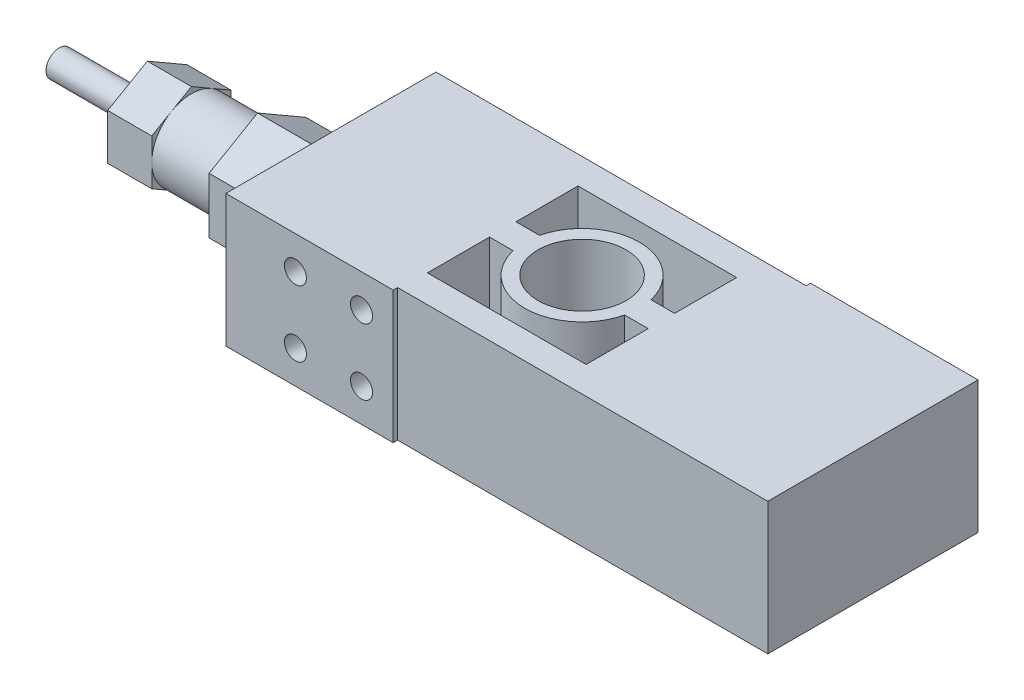
from build123d import *

# Parameters (mm, degrees)
IZIM1_W                     = 122
IZIM1_H                     = 30
Y_KSEKLIK_EKSTR_ZYON1_DEPTH = 46.7
IZIM2_W                     = 38
IZIM2_H                     = 30
Y_KSEKLIK_EKSTR_ZYON2_DEPTH = 1
IZIM3_R                     = 2.5
KES_EKSTR_ZYON1_DEPTH       = 20
KES_EKSTR_ZYON2_DEPTH       = 38
IZIM5_R                     = 10
KES_EKSTR_ZYON3_DEPTH       = 38
Y_KSEKLIK_EKSTR_ZYON3_DEPTH = 14.5
IZIM7_R                     = 9
Y_KSEKLIK_EKSTR_ZYON4_DEPTH = 15
IZIM8_W                     = 38
IZIM8_H                     = 30
Y_KSEKLIK_EKSTR_ZYON5_DEPTH = 1
IZIM9_R                     = 2.5
KES_EKSTR_ZYON4_DEPTH       = 20
Y_KSEKLIK_EKSTR_ZYON6_DEPTH = 10
IZIM11_R                    = 3
Y_KSEKLIK_EKSTR_ZYON7_DEPTH = 20


with BuildPart() as part:
    # Çizim1 → Yükseklik-Ekstrüzyon1 (new body)
    with BuildSketch(Plane.XY):
        Rectangle(IZIM1_W, IZIM1_H)
    extrude(amount=Y_KSEKLIK_EKSTR_ZYON1_DEPTH)

    # Çizim2 → Yükseklik-Ekstrüzyon2 (add)
    with BuildSketch(Plane(origin=(0, 0, 0), x_dir=(-1, 0, 0), z_dir=(0, 0, -1))):
        with Locations((-42, 0)):
            Rectangle(IZIM2_W, IZIM2_H)
    extrude(amount=Y_KSEKLIK_EKSTR_ZYON2_DEPTH)

    # Çizim3 → Kes-Ekstrüzyon1 (cut)
    with BuildSketch(Plane(origin=(0, 0, -1), x_dir=(-1, 0, 0), z_dir=(0, 0, -1))):
        with Locations((-29, 7.5)):
            Circle(IZIM3_R)
        with Locations((-44, 7.5)):
            Circle(IZIM3_R)
        with Locations((-44, -7.5)):
            Circle(IZIM3_R)
        with Locations((-29, -7.5)):
            Circle(IZIM3_R)
    extrude(amount=-KES_EKSTR_ZYON1_DEPTH, mode=Mode.SUBTRACT)

    # Çizim4 → Kes-Ekstrüzyon2 (cut)
    with BuildSketch(Plane.XZ.offset(15)):
        with BuildLine():
            Line((13.5, 6.27), (-22.5, 6.27))
            Line((-22.5, 6.27), (-22.5, 20.35))
            Line((-22.5, 20.35), (-17.149110641, 20.35))
            ThreePointArc((-17.149110641, 20.35), (-4.5, 10.35), (8.149110641, 20.35))
            Line((8.149110641, 20.35), (13.5, 20.35))
            Line((13.5, 20.35), (13.5, 6.27))
        make_face()
        with BuildLine():
            Line((13.5, 40.43), (-22.5, 40.43))
            Line((-22.5, 40.43), (-22.5, 26.35))
            Line((-22.5, 26.35), (-17.149110641, 26.35))
            ThreePointArc((-17.149110641, 26.35), (-4.5, 36.35), (8.149110641, 26.35))
            Line((8.149110641, 26.35), (13.5, 26.35))
            Line((13.5, 26.35), (13.5, 40.43))
        make_face()
    extrude(amount=-KES_EKSTR_ZYON2_DEPTH, mode=Mode.SUBTRACT)

    # Çizim5 → Kes-Ekstrüzyon3 (cut)
    with BuildSketch(Plane.XZ.offset(15)):
        with Locations(Location((-4.5, 23.35, 0), (0, 0, 270))):
            Circle(IZIM5_R)
    extrude(amount=-KES_EKSTR_ZYON3_DEPTH, mode=Mode.SUBTRACT)

    # Çizim6 → Yükseklik-Ekstrüzyon3 (add)
    with BuildSketch(Plane.ZY.offset(61)):
        Polygon((26, 12.701705922), (15, 6.350852961), (15, -6.350852961), (26, -12.701705922), (37, -6.350852961), (37, 6.350852961), align=None)
    extrude(amount=Y_KSEKLIK_EKSTR_ZYON3_DEPTH)

    # Çizim7 → Yükseklik-Ekstrüzyon4 (add)
    with BuildSketch(Plane.ZY.offset(75.5)):
        with Locations((26, 0)):
            Circle(IZIM7_R)
    extrude(amount=Y_KSEKLIK_EKSTR_ZYON4_DEPTH)

    # Çizim8 → Yükseklik-Ekstrüzyon5 (add)
    with BuildSketch(Plane.XY.offset(46.7)):
        with Locations((-42, 0)):
            Rectangle(IZIM8_W, IZIM8_H)
    extrude(amount=Y_KSEKLIK_EKSTR_ZYON5_DEPTH)

    # Çizim9 → Kes-Ekstrüzyon4 (cut)
    with BuildSketch(Plane.XY.offset(47.7)):
        with Locations((-45.2, 7.5)):
            Circle(IZIM9_R)
        with Locations((-45.2, -7.5)):
            Circle(IZIM9_R)
        with Locations((-30.2, -7.5)):
            Circle(IZIM9_R)
        with Locations((-30.2, 7.5)):
            Circle(IZIM9_R)
    extrude(amount=-KES_EKSTR_ZYON4_DEPTH, mode=Mode.SUBTRACT)

    # Çizim10 → Yükseklik-Ekstrüzyon6 (add)
    with BuildSketch(Plane.ZY.offset(90.5)):
        Polygon((26, 10.392304845), (17, 5.196152423), (17, -5.196152423), (26, -10.392304845), (35, -5.196152423), (35, 5.196152423), align=None)
    extrude(amount=Y_KSEKLIK_EKSTR_ZYON6_DEPTH)

    # Çizim11 → Yükseklik-Ekstrüzyon7 (add)
    with BuildSketch(Plane.ZY.offset(100.5)):
        with Locations((26, 0)):
            Circle(IZIM11_R)
    extrude(amount=Y_KSEKLIK_EKSTR_ZYON7_DEPTH)


solid = part.part
